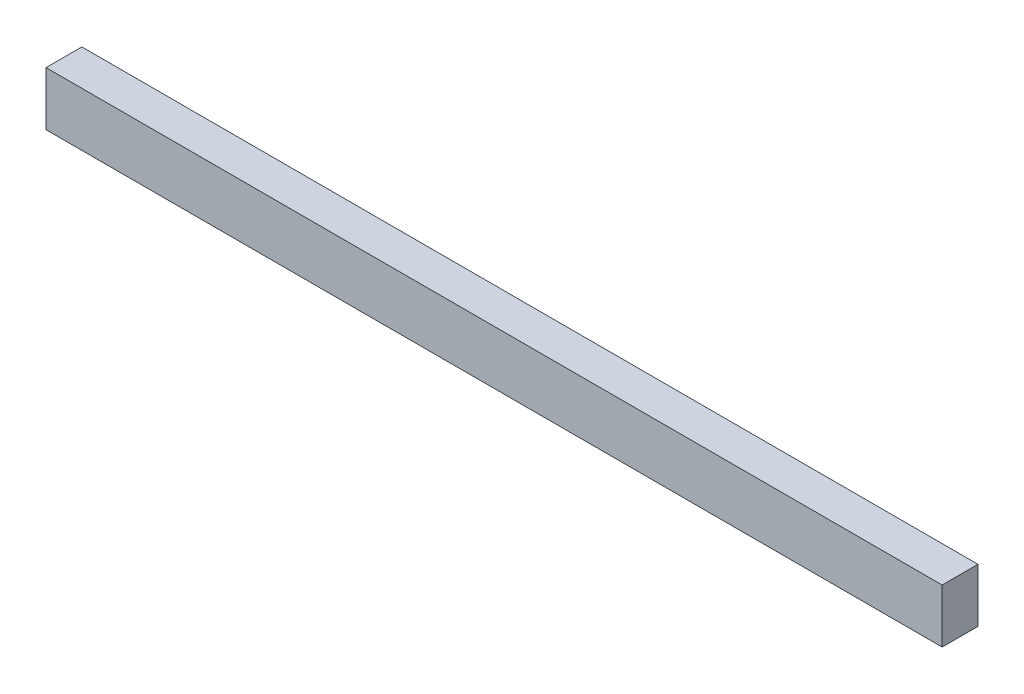
from build123d import *

# Parameters (mm, degrees)
SKETCH2_W           = 25
SKETCH2_H           = 1.5
BOSS_EXTRUDE1_DEPTH = 1


with BuildPart() as part:
    # Sketch2 → Boss-Extrude1 (new body)
    with BuildSketch(Plane.XY):
        with Locations((12.5, 0.75)):
            Rectangle(SKETCH2_W, SKETCH2_H)
    extrude(amount=BOSS_EXTRUDE1_DEPTH)


solid = part.part
